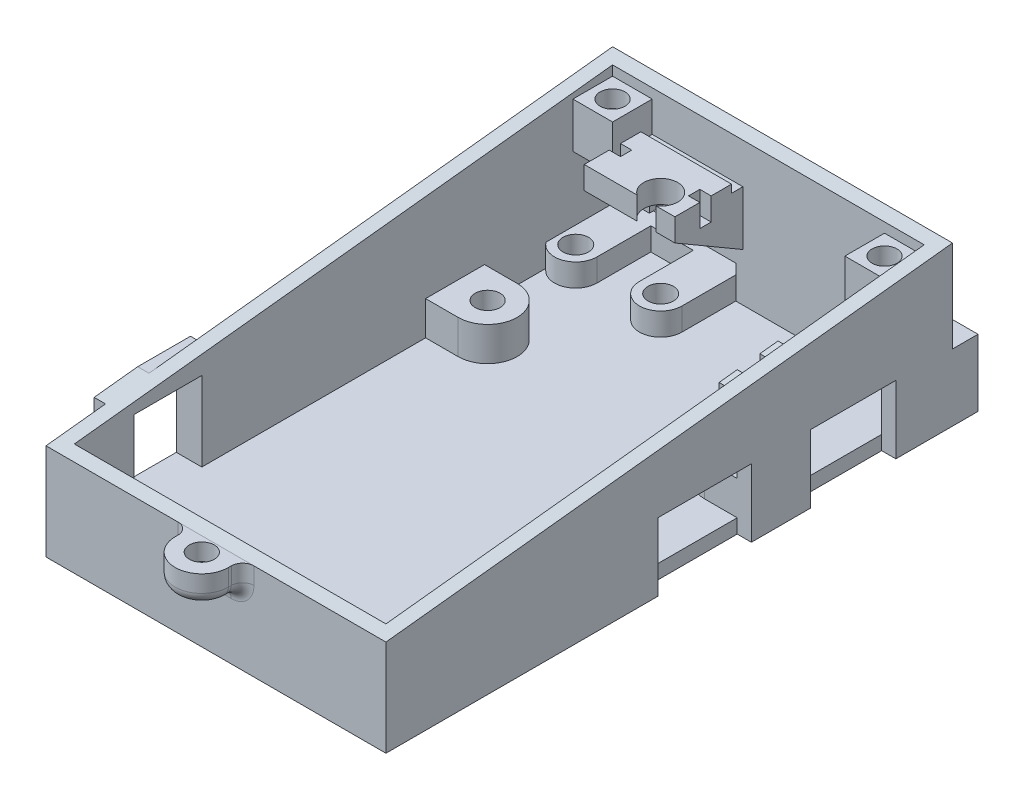
from build123d import *

# Parameters (mm, degrees)
EXTRUDE_1_DEPTH     = 60
SHELL_1_T           = -2.5
SKETCH_3_R          = 2.25
EXTRUDE_3_DEPTH     = 4
CUT_EXTRUDE_1_DEPTH = 118.856904762
SKETCH_5_R          = 2.2
EXTRUDE_4_DEPTH     = 6
SKETCH_7_W          = 42
SKETCH_7_H          = 12
CUT_EXTRUDE_3_DEPTH = 2.5
SKETCH_8_W          = 10.4
SKETCH_8_H          = 12
EXTRUDE_5_DEPTH     = 2.5
SKETCH_9_W          = 7
SKETCH_9_H          = 7
SKETCH_9_R          = 2.2
EXTRUDE_6_DEPTH     = 8
SKETCH_10_R         = 2.2
EXTRUDE_7_DEPTH     = 5
EXTRUDE_8_DEPTH     = 4
EXTRUDE_10_DEPTH    = 4
SKETCH_14_R         = 3
CUT_EXTRUDE_4_DEPTH = 119.584358159
SKETCH_15_W         = 16
SKETCH_15_H         = 2
CUT_EXTRUDE_5_DEPTH = 1.4
CUT_EXTRUDE_6_REACH = 121.933
SKETCH_16_W         = 12
SKETCH_16_H         = 14
SKETCH_17_W         = 12
SKETCH_17_H         = 14
EXTRUDE_14_DEPTH    = 2
EXTRUDE_15_REACH    = 120.238
SKETCH_18_W         = 3.2
SKETCH_18_H         = 3.2
SKETCH_19_W         = 5.75
SKETCH_19_H         = 10.4
CUT_EXTRUDE_7_DEPTH = 4
SKETCH_20_W         = 55
SKETCH_20_H         = 3
CUT_EXTRUDE_8_DEPTH = 0.5
SKETCH_22_R         = 2.2
EXTRUDE_17_DEPTH    = 5
SKETCH_23_R         = 2.897416755
EXTRUDE_18_DEPTH    = 2
FILLET_1_R          = 2
CUT_EXTRUDE_9_REACH = 127.999
SKETCH_25_W         = 5.8
SKETCH_25_H         = 5.8
SKETCH_26_W         = 5.8
SKETCH_26_H         = 4
EXTRUDE_19_DEPTH    = 1
SKETCH_27_W         = 10
SKETCH_27_H         = 4
EXTRUDE_20_DEPTH    = 2
SKETCH_28_W         = 11.8
SKETCH_28_H         = 11.8
SKETCH_28_W_2       = 5.8
SKETCH_28_H_2       = 5.8
EXTRUDE_23_DEPTH    = 4.5


with BuildPart() as part:
    # 草图1 → 凸台-拉伸1 (new body)
    with BuildSketch(Plane(origin=(0, 0, 0), x_dir=(0, 0, -1), z_dir=(1, 0, 0))):
        Polygon((0, 0), (100, 0), (100, 28), (0, 17), align=None)
    extrude(amount=EXTRUDE_1_DEPTH)

    # 抽壳1
    shell_1_openings = [part.faces().sort_by_distance(p)[0] for p in [
        (30, 22.5, -50),
    ]]
    offset(amount=SHELL_1_T, openings=shell_1_openings, kind=Kind.INTERSECTION)

    # 草图3 → 凸台-拉伸3 (add)
    # profile 1 of 2: a face of its own
    with BuildSketch(Plane(origin=(0, 2.5, 0), x_dir=(1, 0, 0), z_dir=(0, 1, 0))):
        with BuildLine():
            Line((2.5, 97.5), (2.5, 85.75))
            ThreePointArc((2.5, 85.75), (6.685854123, 84.442437632), (9.25, 88))
            Line((9.25, 88), (9.25, 97.5))
            Line((9.25, 97.5), (2.5, 97.5))
        make_face()
        with Locations(Location((5.5, 88, 0), (0, 0, 270))):
            Circle(SKETCH_3_R, mode=Mode.SUBTRACT)
    # profile 2 of 2: a face of its own
    with BuildSketch(Plane(origin=(0, 2.5, 0), x_dir=(1, 0, 0), z_dir=(0, 1, 0))):
        with BuildLine():
            Line((16.75, 88), (16.75, 97.5))
            Line((16.75, 97.5), (24.25, 97.5))
            Line((24.25, 97.5), (24.25, 88))
            ThreePointArc((24.25, 88), (20.5, 84.25), (16.75, 88))
        make_face()
        with Locations(Location((20.5, 88, 0), (0, 0, 270))):
            Circle(SKETCH_3_R, mode=Mode.SUBTRACT)
    extrude(amount=EXTRUDE_3_DEPTH)

    # 草图4 → 切除-拉伸1 (cut, through all)
    with BuildSketch(Plane.XY.offset(-97.5)):
        Polygon((17, 8.3), (24.25, 8.3), (24.25, 6.5), (2.5, 6.5), (2.5, 8.3), (9, 8.3), (9, 13), (17, 13), align=None)
    extrude(amount=-CUT_EXTRUDE_1_DEPTH, mode=Mode.SUBTRACT)

    # 草图5 → 凸台-拉伸4 (add)
    # profile 1 of 4: a face of its own
    with BuildSketch(Plane(origin=(0, 2.5, 0), x_dir=(1, 0, 0), z_dir=(0, 1, 0))):
        with BuildLine():
            Line((5.032858412, 2.5), (11.467141588, 2.5))
            ThreePointArc((11.467141588, 2.5), (8.25, 9.4), (5.032858412, 2.5))
        make_face()
        with Locations(Location((8.25, 5.2, 0), (0, 0, 270))):
            Circle(SKETCH_5_R, mode=Mode.SUBTRACT)
    # profile 2 of 4: a face of its own
    with BuildSketch(Plane(origin=(0, 2.5, 0), x_dir=(1, 0, 0), z_dir=(0, 1, 0))):
        with BuildLine():
            Line((48.532858412, 2.5), (54.967141588, 2.5))
            ThreePointArc((54.967141588, 2.5), (51.75, 9.4), (48.532858412, 2.5))
        make_face()
        with Locations(Location((51.75, 5.2, 0), (0, 0, 90))):
            Circle(SKETCH_5_R, mode=Mode.SUBTRACT)
    # profile 3 of 4: a face of its own
    with BuildSketch(Plane(origin=(0, 2.5, 0), x_dir=(1, 0, 0), z_dir=(0, 1, 0))):
        with BuildLine():
            Line((8.25, 74.9), (2.5, 74.9))
            Line((2.5, 74.9), (2.5, 64.5))
            Line((2.5, 64.5), (8.25, 64.5))
            ThreePointArc((8.25, 64.5), (13.45, 69.7), (8.25, 74.9))
        make_face()
        with Locations(Location((8.25, 69.7, 0), (0, 0, 270))):
            Circle(SKETCH_5_R, mode=Mode.SUBTRACT)
    # profile 4 of 4: a face of its own
    with BuildSketch(Plane(origin=(0, 2.5, 0), x_dir=(1, 0, 0), z_dir=(0, 1, 0))):
        with BuildLine():
            Line((51.75, 74.9), (57.5, 74.9))
            Line((57.5, 74.9), (57.5, 64.5))
            Line((57.5, 64.5), (51.75, 64.5))
            ThreePointArc((51.75, 64.5), (46.55, 69.7), (51.75, 74.9))
        make_face()
        with Locations(Location((51.75, 69.7, 0), (0, 0, 90))):
            Circle(SKETCH_5_R, mode=Mode.SUBTRACT)
    extrude(amount=EXTRUDE_4_DEPTH)

    # 草图7 → 切除-拉伸3 (cut)
    with BuildSketch(Plane(origin=(60, 0, 0), x_dir=(0, 0, -1), z_dir=(1, 0, 0))):
        with Locations((69, 6)):
            Rectangle(SKETCH_7_W, SKETCH_7_H)
    extrude(amount=-CUT_EXTRUDE_3_DEPTH, mode=Mode.SUBTRACT)

    # 草图8 → 凸台-拉伸5 (add)
    with BuildSketch(Plane(origin=(57.5, 0, 0), x_dir=(0, 0, -1), z_dir=(1, 0, 0))):
        with Locations((69.7, 6)):
            Rectangle(SKETCH_8_W, SKETCH_8_H)
    extrude(amount=EXTRUDE_5_DEPTH)

    # 草图9 → 凸台-拉伸6 (add)
    with BuildSketch(Plane(origin=(0, 18, 0), x_dir=(1, 0, 0), z_dir=(0, 1, 0))):
        with Locations((6, 94)):
            Rectangle(SKETCH_9_W, SKETCH_9_H)
        with Locations(Location((6, 94, 0), (0, 0, 270))):
            Circle(SKETCH_9_R, mode=Mode.SUBTRACT)
    extrude_6 = extrude(amount=EXTRUDE_6_DEPTH)

    # 草图10 → 凸台-拉伸7 (add)
    with BuildSketch(Plane.XZ.offset(-18)):
        with Locations(Location((6, -94, 0), (0, 0, 270))):
            Circle(SKETCH_10_R)
    extrude(amount=-EXTRUDE_7_DEPTH)

    # 草图11 → 凸台-拉伸8 (add)
    with BuildSketch(Plane.XZ.offset(-18)):
        Polygon((9.5, -97.5), (25.5, -97.5), (25.5, -91.9), (23.5, -91.9), (23.5, -89.9), (25.5, -89.9), (25.5, -85.5), (9.5, -85.5), (9.5, -89.9), (11.5, -89.9), (11.5, -91.9), (9.5, -91.9), align=None)
    extrude(amount=-EXTRUDE_8_DEPTH)

    # 草图13 → 凸台-拉伸10 (add)
    with BuildSketch(Plane(origin=(25.5, 0, 0), x_dir=(0, 0, -1), z_dir=(1, 0, 0))):
        Polygon((85.5, 18), (97.5, 11), (97.5, 18), align=None)
    extrude(amount=-EXTRUDE_10_DEPTH)

    # 草图14 → 切除-拉伸4 (cut, through all)
    with BuildSketch(Plane(origin=(0, 6.5, 0), x_dir=(1, 0, 0), z_dir=(0, 1, 0))):
        with Locations((20.5, 88)):
            Circle(SKETCH_14_R)
    extrude(amount=CUT_EXTRUDE_4_DEPTH, mode=Mode.SUBTRACT)

    # 草图15 → 切除-拉伸5 (cut)
    with BuildSketch(Plane(origin=(0, 22, 0), x_dir=(1, 0, 0), z_dir=(0, 1, 0))):
        with Locations((17.5, 96.5)):
            Rectangle(SKETCH_15_W, SKETCH_15_H)
    extrude(amount=-CUT_EXTRUDE_5_DEPTH, mode=Mode.SUBTRACT)

    # 镜向2: 凸台-拉伸6 across plane
    add(extrude_6.mirror(Plane.ZY.offset(-30)))

    # 草图16 → 切除-拉伸6 (cut, up to next)
    with BuildSketch(Plane.ZY, mode=Mode.PRIVATE) as cut_extrude_6_sk1:
        with Locations((-19, 9.5)):
            Rectangle(SKETCH_16_W, SKETCH_16_H)
    cut_extrude_6_tool1 = extrude(cut_extrude_6_sk1.sketch, amount=-CUT_EXTRUDE_6_REACH, mode=Mode.PRIVATE) & part.part
    add(cut_extrude_6_tool1.solids().sort_by_distance((0, 9.5, -19))[0], mode=Mode.SUBTRACT)

    # 草图17 → 凸台-拉伸14 (add)
    with BuildSketch(Plane.ZY):
        Polygon((-27.5, 0), (-10.5, 0), (-10.5, 18.155), (-18.181818182, 19), (-27.5, 19), align=None)
        with Locations((-19, 9.5)):
            Rectangle(SKETCH_17_W, SKETCH_17_H, mode=Mode.SUBTRACT)
    extrude(amount=EXTRUDE_14_DEPTH)

    # 凸台-拉伸15: up to this plane
    extrude_15_end = Plane(origin=(60, 25.51498911, -100.273351198), z_dir=(0, -0.9940043559354329, -0.10934047915289762))
    # 草图18 → 凸台-拉伸15 (add, up to the surface)
    with BuildSketch(Plane(origin=(0, 8.5, 0), x_dir=(1, 0, 0), z_dir=(0, 1, 0)), mode=Mode.PRIVATE) as extrude_15_sk1:
        with Locations((55.9, 73.3)):
            Rectangle(SKETCH_18_W, SKETCH_18_H)
    extrude_15_tool1 = split(extrude(extrude_15_sk1.sketch, amount=EXTRUDE_15_REACH, mode=Mode.PRIVATE), bisect_by=extrude_15_end, keep=Keep.BOTH, mode=Mode.PRIVATE)
    add(extrude_15_tool1.solids().sort_by_distance((55.9, 8.5, -73.3))[0])
    # 草图18 → 凸台-拉伸15 (add, up to the surface)
    with BuildSketch(Plane(origin=(0, 8.5, 0), x_dir=(1, 0, 0), z_dir=(0, 1, 0)), mode=Mode.PRIVATE) as extrude_15_sk2:
        with Locations((55.9, 66.1)):
            Rectangle(SKETCH_18_W, SKETCH_18_H)
    extrude_15_tool2 = split(extrude(extrude_15_sk2.sketch, amount=EXTRUDE_15_REACH, mode=Mode.PRIVATE), bisect_by=extrude_15_end, keep=Keep.BOTH, mode=Mode.PRIVATE)
    add(extrude_15_tool2.solids().sort_by_distance((55.9, 8.5, -66.1))[0])

    # 草图19 → 切除-拉伸7 (cut)
    with BuildSketch(Plane(origin=(0, 8.5, 0), x_dir=(1, 0, 0), z_dir=(0, 1, 0))):
        with Locations((54.625, 69.7)):
            Rectangle(SKETCH_19_W, SKETCH_19_H)
    extrude(amount=CUT_EXTRUDE_7_DEPTH, mode=Mode.SUBTRACT)

    # 草图20 → 切除-拉伸8 (cut)
    with BuildSketch(Plane(origin=(0, 0, -2.5), x_dir=(-1, 0, 0), z_dir=(0, 0, -1))):
        with Locations((-30, 10)):
            Rectangle(SKETCH_20_W, SKETCH_20_H)
    extrude(amount=-CUT_EXTRUDE_8_DEPTH, mode=Mode.SUBTRACT)

    # 草图22 → 凸台-拉伸17 (add)
    with BuildSketch(Plane(origin=(0, 17, 0), x_dir=(1, 0, 0), z_dir=(0, 1, 0))):
        with BuildLine():
            Line((25.3, -2.5), (25.3, 0))
            Line((25.3, 0), (34.7, 0))
            Line((34.7, 0), (34.7, -2.5))
            ThreePointArc((34.7, -2.5), (30, -7.2), (25.3, -2.5))
        make_face()
        with Locations(Location((30, -2.5, 0), (0, 0, 270))):
            Circle(SKETCH_22_R, mode=Mode.SUBTRACT)
    extrude(amount=-EXTRUDE_17_DEPTH)

    # 草图23 → 凸台-拉伸18 (add)
    with BuildSketch(Plane.XZ.offset(-12)):
        with Locations((30, 2.5)):
            Circle(SKETCH_23_R)
    extrude(amount=-EXTRUDE_18_DEPTH)

    # 圆角1
    fillet_1_edges = [part.edges().sort_by_distance(p)[0] for p in [
        (30, 12, 7.2),
        (25.3, 12, 1.25),
        (30, 12, 0),
        (25.3, 14.5, 0),
        (34.7, 12, 1.25),
        (34.7, 14.5, 0),
    ]]
    fillet(fillet_1_edges, radius=FILLET_1_R)

    # 草图25 → 切除-拉伸9 (cut, up to next)
    with BuildSketch(Plane(origin=(0, 0, -100), x_dir=(-1, 0, 0), z_dir=(0, 0, -1)), mode=Mode.PRIVATE) as cut_extrude_9_sk1:
        with Locations((-54.1, 5.9)):
            Rectangle(SKETCH_25_W, SKETCH_25_H)
    cut_extrude_9_tool1 = extrude(cut_extrude_9_sk1.sketch, amount=-CUT_EXTRUDE_9_REACH, mode=Mode.PRIVATE) & part.part
    add(cut_extrude_9_tool1.solids().sort_by_distance((54.1, 5.9, -100))[0], mode=Mode.SUBTRACT)

    # 草图26 → 凸台-拉伸19 (add)
    with BuildSketch(Plane.XY.offset(-97.5)):
        with Locations((54.1, 5.9)):
            Rectangle(SKETCH_26_W, SKETCH_26_H)
    extrude(amount=-EXTRUDE_19_DEPTH)

    # 草图27 → 凸台-拉伸20 (add)
    with BuildSketch(Plane.XY.offset(-97.5)):
        with Locations((54.1, 5.9)):
            Rectangle(SKETCH_27_W, SKETCH_27_H)
    extrude(amount=EXTRUDE_20_DEPTH)

    # 草图28 → 凸台-拉伸23 (add)
    with BuildSketch(Plane(origin=(0, 0, -100), x_dir=(-1, 0, 0), z_dir=(0, 0, -1))):
        with Locations((-54.1, 5.9)):
            Rectangle(SKETCH_28_W, SKETCH_28_H)
        with Locations((-54.1, 5.9)):
            Rectangle(SKETCH_28_W_2, SKETCH_28_H_2, mode=Mode.SUBTRACT)
    extrude(amount=EXTRUDE_23_DEPTH)


solid = part.part
